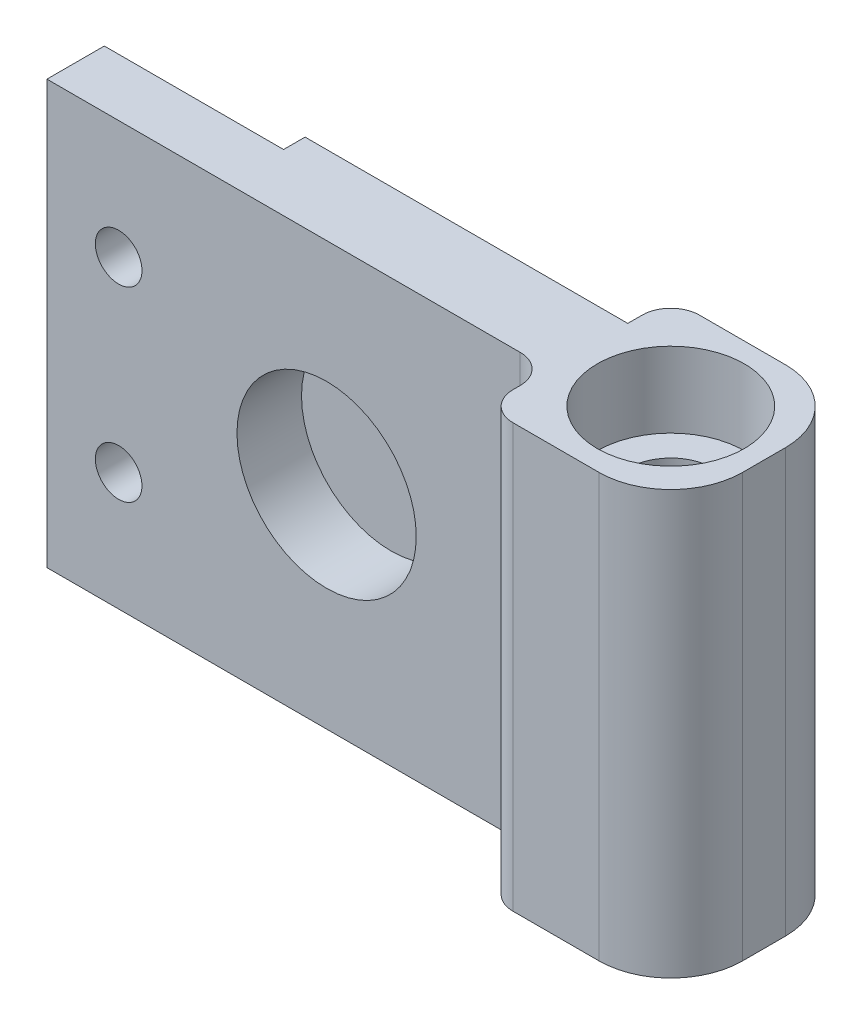
from build123d import *

# Parameters (mm, degrees)
SKETCH1_W                = 13
SKETCH1_H                = 13
BALL_BEARING_BLOCK_DEPTH = 29.5
SKETCH2_W                = 35
SKETCH2_H                = 4
PADDLE_PLATE_DEPTH       = 29.5
SKETCH3_R                = 5.125
BALLBEARING_1_DEPTH      = 5.25
BALLBEARING_START        = -5
SKETCH4_R                = 5.125
BALLBEARING_2_DEPTH      = 5
SKETCH5_R                = 3
ACHSE_DEPTH              = 19.25
FILLET1_R                = 5
FILLET2_R                = 5
FILLET3_R                = 2
FILLET4_R                = 2
FILLET7_R                = 2
SKETCH6_R                = 1.625
M3_PADDLE_SCREWS_DEPTH   = 4
SKETCH8_W                = 22.5
SKETCH8_H                = 29.5
TOP_PLATE_DEPTH          = 1.5
SKETCH7_R                = 6.25
MAGNET_POCKET_DEPTH      = 4.5


with BuildPart() as part:
    # Sketch1 → Ball Bearing Block (new body)
    with BuildSketch(Plane(origin=(0, 0, 0), x_dir=(1, 0, 0), z_dir=(0, 1, 0))):
        Rectangle(SKETCH1_W, SKETCH1_H)
    extrude(amount=BALL_BEARING_BLOCK_DEPTH)

    # Sketch2 → Paddle Plate (add)
    with BuildSketch(Plane.XZ):
        with Locations((-24, 0)):
            Rectangle(SKETCH2_W, SKETCH2_H)
    extrude(amount=-PADDLE_PLATE_DEPTH)

    # Sketch3 → Ballbearing 1 (cut)
    with BuildSketch(Plane(origin=(0, 29.5, 0), x_dir=(1, 0, 0), z_dir=(0, 1, 0))):
        with Locations(Location((0, 0, 0), (0, 0, 270))):
            Circle(SKETCH3_R)
    extrude(amount=-BALLBEARING_1_DEPTH, mode=Mode.SUBTRACT)

    # Sketch4 → Ballbearing 2 (cut)
    with BuildSketch(Plane.XZ.offset(BALLBEARING_START)):
        with Locations(Location((0, 0, 0), (0, 0, 90))):
            Circle(SKETCH4_R)
    extrude(amount=BALLBEARING_2_DEPTH, mode=Mode.SUBTRACT)

    # Sketch5 → Achse (cut)
    with BuildSketch(Plane(origin=(0, 24.25, 0), x_dir=(1, 0, 0), z_dir=(0, 1, 0))):
        with Locations(Location((0, 0, 0), (0, 0, 270))):
            Circle(SKETCH5_R)
    extrude(amount=-ACHSE_DEPTH, mode=Mode.SUBTRACT)

    # Fillet1
    fillet1_edges = [part.edges().sort_by_distance(p)[0] for p in [
        (6.5, 14.75, -6.5),
    ]]
    fillet(fillet1_edges, radius=FILLET1_R)

    # Fillet2
    fillet2_edges = [part.edges().sort_by_distance(p)[0] for p in [
        (6.5, 14.75, 6.5),
    ]]
    fillet(fillet2_edges, radius=FILLET2_R)

    # Fillet3
    fillet3_edges = [part.edges().sort_by_distance(p)[0] for p in [
        (-6.5, 14.75, -6.5),
    ]]
    fillet(fillet3_edges, radius=FILLET3_R)

    # Fillet4
    fillet4_edges = [part.edges().sort_by_distance(p)[0] for p in [
        (-6.5, 14.75, 6.5),
    ]]
    fillet(fillet4_edges, radius=FILLET4_R)

    # Fillet7
    fillet7_edges = [part.edges().sort_by_distance(p)[0] for p in [
        (-6.5, 14.75, 2),
    ]]
    fillet(fillet7_edges, radius=FILLET7_R)

    # Sketch6 → M3 Paddle Screws (cut)
    with BuildSketch(Plane(origin=(0, 0, -2), x_dir=(-1, 0, 0), z_dir=(0, 0, -1))):
        with Locations((36.5, 8.25)):
            Circle(SKETCH6_R)
        with Locations(Location((36.5, 21.25, 0), (0, 0, 180))):
            Circle(SKETCH6_R)
    extrude(amount=-M3_PADDLE_SCREWS_DEPTH, mode=Mode.SUBTRACT)

    # Sketch8 → Top Plate (add)
    with BuildSketch(Plane(origin=(0, 0, -2), x_dir=(-1, 0, 0), z_dir=(0, 0, -1))):
        with Locations((17.75, 14.75)):
            Rectangle(SKETCH8_W, SKETCH8_H)
    extrude(amount=TOP_PLATE_DEPTH)

    # Sketch7 → Magnet Pocket (cut)
    with BuildSketch(Plane(origin=(0, 0, 2), x_dir=(-1, 0, 0), z_dir=(0, 0, -1))):
        with Locations((22, 14.75)):
            Circle(SKETCH7_R)
    extrude(amount=MAGNET_POCKET_DEPTH, mode=Mode.SUBTRACT)


solid = part.part
